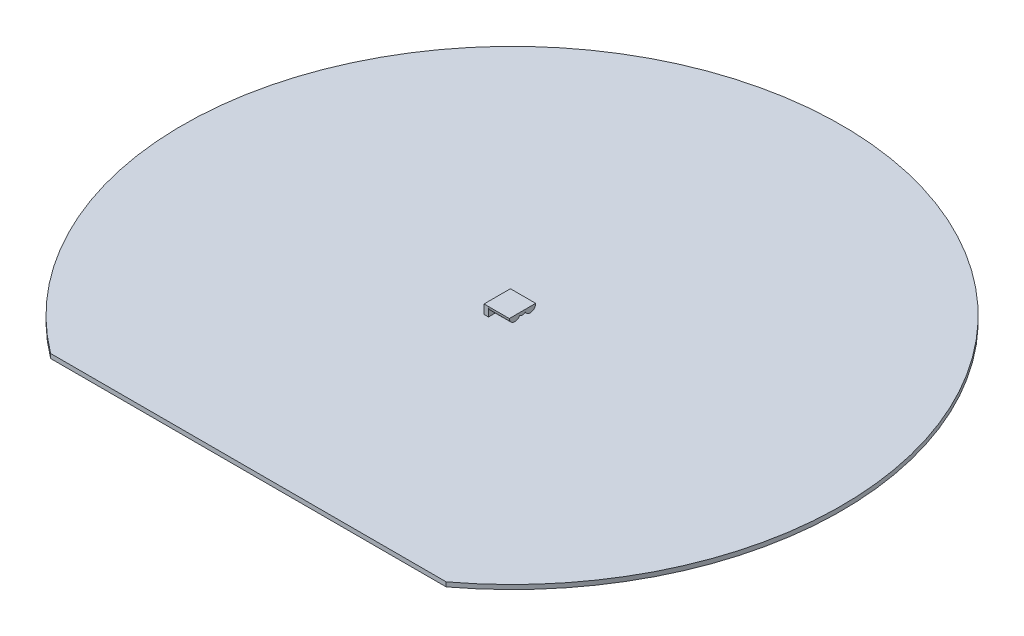
from build123d import *

# Parameters (mm, degrees)
ESQUISSE1_R             = 150
BOSS_EXTRU_1_DEPTH      = 2
ESQUISSE2_W             = 11.5
ESQUISSE2_H             = 13.5
BOSS_EXTRU_2_DEPTH      = 7
ENL_V_MAT_EXTRU_2_DEPTH = 30
ENL_V_MAT_EXTRU_3_DEPTH = 9.5
ENL_V_MAT_EXTRU_4_DEPTH = 213.172624294


with BuildPart() as part:
    # Esquisse1 → Boss.-Extru.1 (new body)
    with BuildSketch(Plane(origin=(0, 0, 0), x_dir=(1, 0, 0), z_dir=(0, 1, 0))):
        Circle(ESQUISSE1_R)
    extrude(amount=BOSS_EXTRU_1_DEPTH)

    # Esquisse2 → Boss.-Extru.2 (add)
    with BuildSketch(Plane(origin=(0, 2, 0), x_dir=(1, 0, 0), z_dir=(0, 1, 0))):
        with Locations((-1, 0)):
            Rectangle(ESQUISSE2_W, ESQUISSE2_H)
    extrude(amount=BOSS_EXTRU_2_DEPTH)

    # Esquisse3 → Enlèv. mat.-Extru.2 (cut)
    with BuildSketch(Plane(origin=(4.75, 0, 0), x_dir=(0, 0, -1), z_dir=(1, 0, 0))):
        Polygon((-6, 2), (-6, 6.15), (-1.65, 6.15), (1.65, 6.15), (6, 6.15), (6, 2), (6.75, 2), (6.75, 9), (-6.75, 9), (-6.75, 2), align=None)
    extrude(amount=-ENL_V_MAT_EXTRU_2_DEPTH, mode=Mode.SUBTRACT)

    # Esquisse3<3> → Enlèv. mat.-Extru.3 (cut)
    with BuildSketch(Plane(origin=(4.75, 0, 0), x_dir=(0, 0, -1), z_dir=(1, 0, 0))):
        with BuildLine():
            ThreePointArc((-1.246071429, 5.0684243), (-4.054607326, 3.712293965), (-6, 6.15))
            Line((-6, 6.15), (-6, 2))
            Line((-6, 2), (6, 2))
            Line((6, 2), (6, 6.15))
            ThreePointArc((6, 6.15), (4.054607326, 3.712293965), (1.246071429, 5.0684243))
            ThreePointArc((1.246071429, 5.0684243), (0, 4.5), (-1.246071429, 5.0684243))
        make_face()
    extrude(amount=-ENL_V_MAT_EXTRU_3_DEPTH, mode=Mode.SUBTRACT)

    # Esquisse4 → Enlèv. mat.-Extru.4 (cut, through all)
    with BuildSketch(Plane(origin=(0, 2, 0), x_dir=(1, 0, 0), z_dir=(0, 1, 0))):
        with BuildLine():
            Line((-90, -120), (90, -120))
            ThreePointArc((90, -120), (0, -150), (-90, -120))
        make_face()
    extrude(amount=-ENL_V_MAT_EXTRU_4_DEPTH, mode=Mode.SUBTRACT)


solid = part.part
